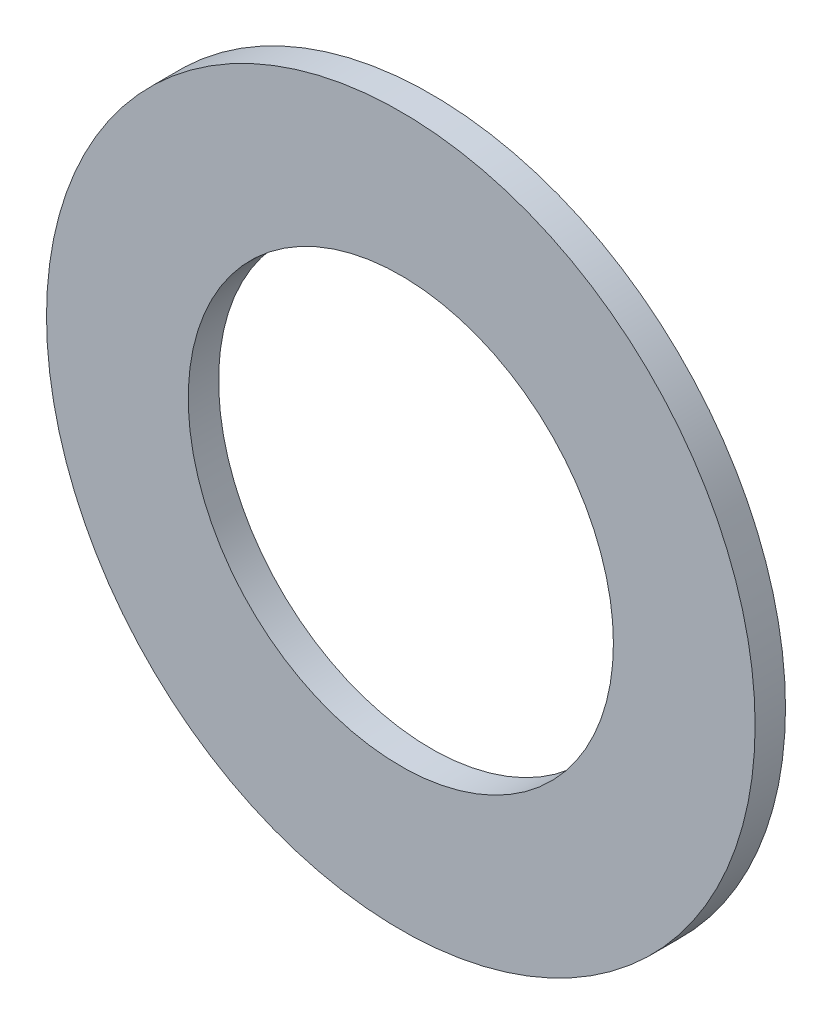
from build123d import *

# Parameters (mm, degrees)
SKETCH_2_R      = 3.5
SKETCH_2_R_2    = 2.1
EXTRUDE_1_DEPTH = 0.3


with BuildPart() as part:
    # 草图2 → 凸台-拉伸1 (new body)
    with BuildSketch(Plane.XY):
        Circle(SKETCH_2_R)
        Circle(SKETCH_2_R_2, mode=Mode.SUBTRACT)
    extrude(amount=EXTRUDE_1_DEPTH)


solid = part.part
